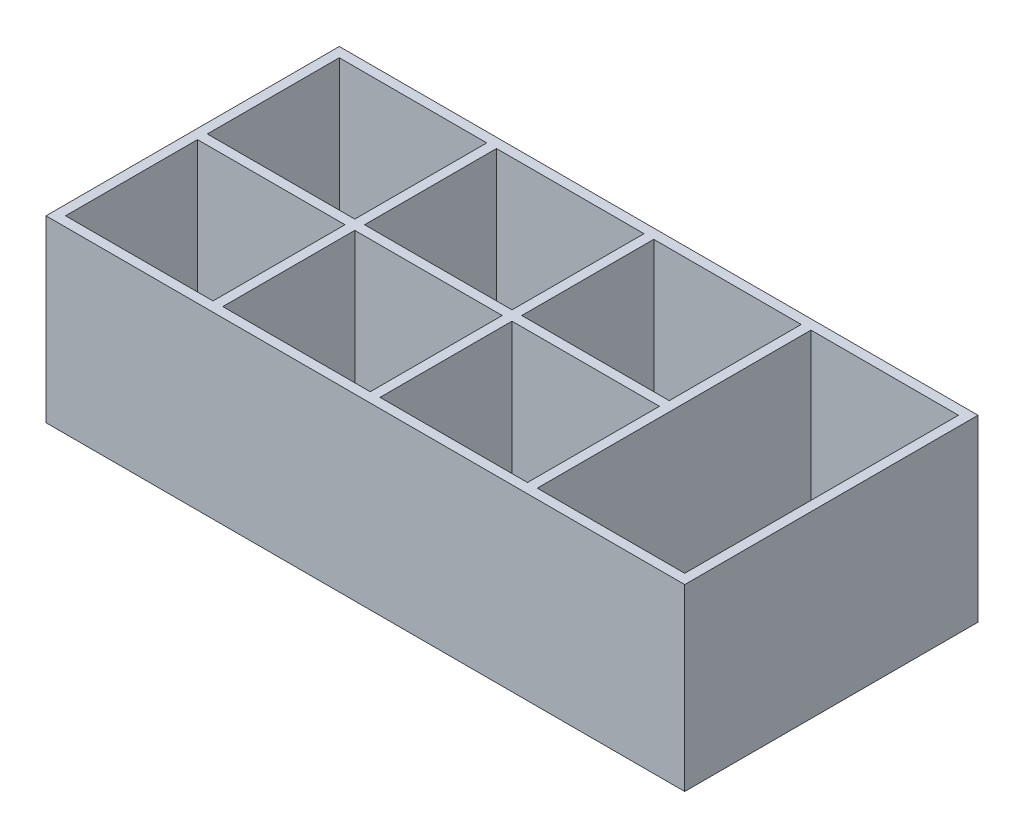
from build123d import *

# Parameters (mm, degrees)
SKETCH1_W           = 196
SKETCH1_H           = 90
BOSS_EXTRUDE1_DEPTH = 55
SKETCH2_W           = 45.25
SKETCH2_H           = 40.5
SKETCH2_H_2         = 84
CUT_EXTRUDE1_DEPTH  = 52


with BuildPart() as part:
    # Sketch1 → Boss-Extrude1 (new body)
    with BuildSketch(Plane(origin=(0, 0, 0), x_dir=(1, 0, 0), z_dir=(0, 1, 0))):
        Rectangle(SKETCH1_W, SKETCH1_H)
    extrude(amount=BOSS_EXTRUDE1_DEPTH)

    # Sketch2 → Cut-Extrude1 (cut)
    with BuildSketch(Plane(origin=(0, 55, 0), x_dir=(1, 0, 0), z_dir=(0, 1, 0))):
        with Locations((-72.375, 21.75)):
            Rectangle(SKETCH2_W, SKETCH2_H)
        with Locations((-72.375, -21.75)):
            Rectangle(SKETCH2_W, SKETCH2_H)
        with Locations((-24.125, 21.75)):
            Rectangle(SKETCH2_W, SKETCH2_H)
        with Locations((-24.125, -21.75)):
            Rectangle(SKETCH2_W, SKETCH2_H)
        with Locations((24.125, 21.75)):
            Rectangle(SKETCH2_W, SKETCH2_H)
        with Locations((24.125, -21.75)):
            Rectangle(SKETCH2_W, SKETCH2_H)
        with Locations((72.375, 0)):
            Rectangle(SKETCH2_W, SKETCH2_H_2)
    extrude(amount=-CUT_EXTRUDE1_DEPTH, mode=Mode.SUBTRACT)


solid = part.part
